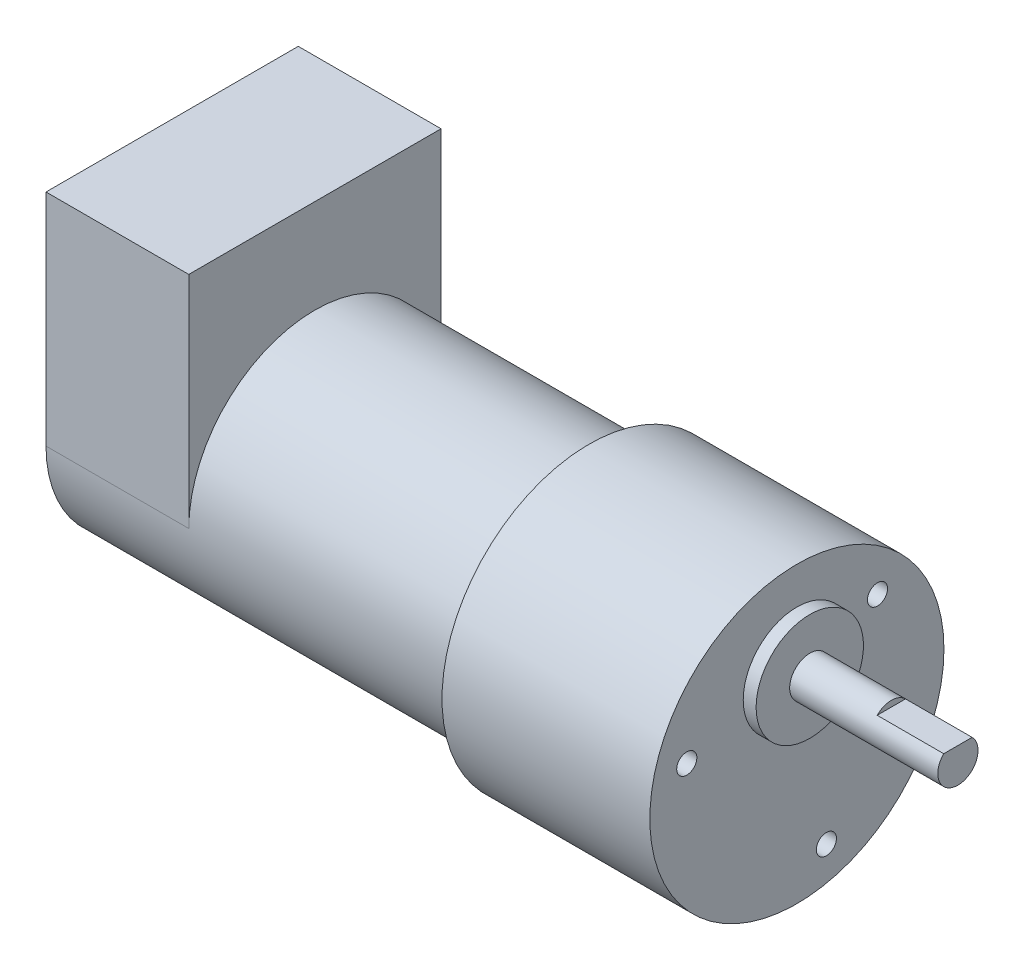
from build123d import *

# Parameters (mm, degrees)
SKETCH1_R           = 14.9225
BOSS_EXTRUDE1_DEPTH = 49.3268
BOSS_EXTRUDE2_DEPTH = 16.891
SKETCH3_R           = 17.399
BOSS_EXTRUDE3_DEPTH = 24.5872
SKETCH4_R           = 2.37871
BOSS_EXTRUDE4_DEPTH = 19.05
SKETCH5_R           = 6.35
BOSS_EXTRUDE5_DEPTH = 1.524
SKETCH6_R           = 1.190625
CUT_EXTRUDE1_DEPTH  = 19.05
CUT_EXTRUDE2_START  = -7.874
CUT_EXTRUDE2_DEPTH  = 7.874


with BuildPart() as part:
    # Sketch1 → Boss-Extrude1 (new body)
    with BuildSketch(Plane(origin=(0, 0, 0), x_dir=(0, 0, -1), z_dir=(1, 0, 0))):
        Circle(SKETCH1_R)
    extrude(amount=BOSS_EXTRUDE1_DEPTH)

    # Sketch2 → Boss-Extrude2 (add)
    with BuildSketch(Plane.ZY):
        with BuildLine():
            Line((-14.9225, 26.035), (14.9225, 26.035))
            Line((14.9225, 26.035), (14.9225, 0))
            ThreePointArc((14.9225, 0), (0, -14.9225), (-14.9225, 0))
            Line((-14.9225, 0), (-14.9225, 26.035))
        make_face()
    extrude(amount=-BOSS_EXTRUDE2_DEPTH)

    # Sketch3 → Boss-Extrude3 (add)
    with BuildSketch(Plane(origin=(49.3268, 0, 0), x_dir=(0, 0, -1), z_dir=(1, 0, 0))):
        Circle(SKETCH3_R)
    extrude(amount=BOSS_EXTRUDE3_DEPTH)

    # Sketch4 → Boss-Extrude4 (add)
    with BuildSketch(Plane(origin=(73.914, 0, 0), x_dir=(0, 0, -1), z_dir=(1, 0, 0))):
        with Locations(Location((0, 6.6548, 0), (0, 0, 180))):
            Circle(SKETCH4_R)
    extrude(amount=BOSS_EXTRUDE4_DEPTH)

    # Sketch5 → Boss-Extrude5 (add)
    with BuildSketch(Plane(origin=(73.914, 0, 0), x_dir=(0, 0, -1), z_dir=(1, 0, 0))):
        with Locations(Location((0, 6.6548, 0), (0, 0, 180))):
            Circle(SKETCH5_R)
    extrude(amount=BOSS_EXTRUDE5_DEPTH)

    # Sketch6 → Cut-Extrude1 (cut)
    with BuildSketch(Plane(origin=(73.914, 0, 0), x_dir=(0, 0, -1), z_dir=(1, 0, 0))):
        with Locations((3.490795989, -13.027827989)):
            Circle(SKETCH6_R)
        with Locations((-13.027827989, 3.490795989)):
            Circle(SKETCH6_R)
        with Locations((9.537032001, 9.537032001)):
            Circle(SKETCH6_R)
    extrude(amount=-CUT_EXTRUDE1_DEPTH, mode=Mode.SUBTRACT)

    # Sketch7 → Cut-Extrude2 (cut)
    with BuildSketch(Plane(origin=(92.964, 0, 0), x_dir=(0, 0, -1), z_dir=(1, 0, 0)).offset(CUT_EXTRUDE2_START)):
        with BuildLine():
            Line((-1.678707503, 8.34009), (1.678707503, 8.34009))
            ThreePointArc((1.678707503, 8.34009), (0, 9.03351), (-1.678707503, 8.34009))
        make_face()
    extrude(amount=CUT_EXTRUDE2_DEPTH, mode=Mode.SUBTRACT)


solid = part.part
